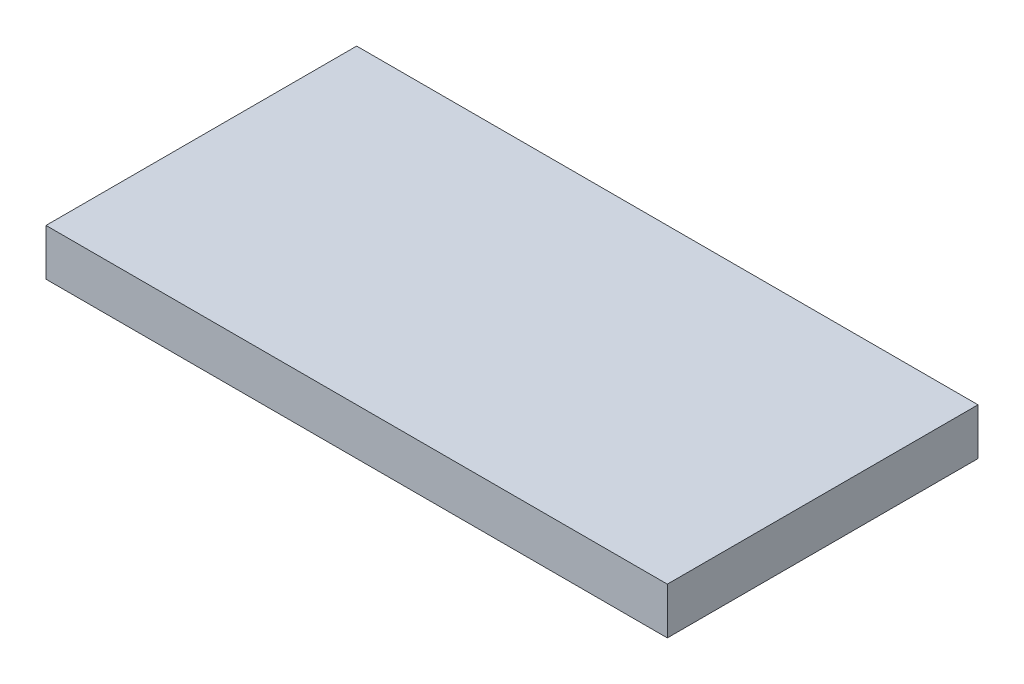
from build123d import *

# Parameters (mm, degrees)
SKETCH1_W           = 80
SKETCH1_H           = 40
BOSS_EXTRUDE1_DEPTH = 6


with BuildPart() as part:
    # Sketch1 → Boss-Extrude1 (new body)
    with BuildSketch(Plane(origin=(0, 0, 0), x_dir=(1, 0, 0), z_dir=(0, 1, 0))):
        Rectangle(SKETCH1_W, SKETCH1_H)
    extrude(amount=BOSS_EXTRUDE1_DEPTH)


solid = part.part
